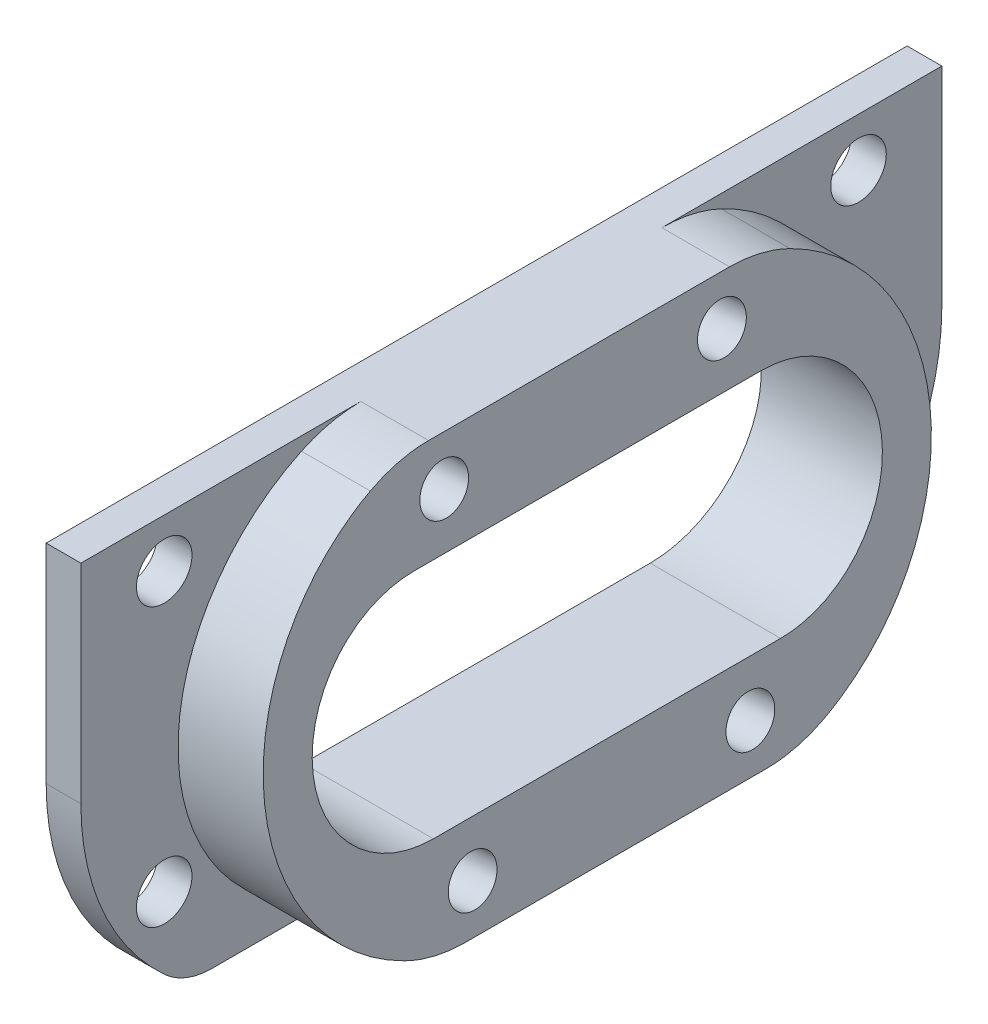
from build123d import *

# Parameters (mm, degrees)
SZKIC1_R                                 = 4
DODANIE_WYCI_GNI_CIE1_DEPTH              = 20
SZKIC2_OUTSIDE_W                         = 153.84
SZKIC2_OUTSIDE_H                         = 89.84
WYTNIJ_WYCI_GNI_CIE1_DEPTH               = 15
WYTNIJ_WYCI_GNI_CIE2_DEPTH               = 130.135587659
WYTNIJ_WYCI_GNI_CIE2_DEPTH_BACK          = 130.135587659
OTW_R_GWINTOWANY_M8X1_01_D               = 7
OTW_R_GWINTOWANY_M8X1_01_DEPTH           = 9.896987833
OTW_R_GWINTOWANY_M8X1_01_TIP             = 2.103012167
OTW_R_GWINTOWANY_M8X1_01_ON_FACE_2_D     = 7
OTW_R_GWINTOWANY_M8X1_01_ON_FACE_2_DEPTH = 9.896987833
OTW_R_GWINTOWANY_M8X1_01_ON_FACE_2_TIP   = 2.103012167


with BuildPart() as part:
    # Szkic1 → Dodanie-wyciągnięcie1 (new body)
    with BuildSketch(Plane(origin=(0, 0, 0), x_dir=(0, 0, -1), z_dir=(1, 0, 0))):
        with BuildLine():
            Line((-43.138357147, -30), (43.138357147, -30))
            ThreePointArc((43.138357147, -30), (46.738768646, -29.329364235), (49.856267202, -27.407407407))
            ThreePointArc((49.856267202, -27.407407407), (58.828108774, -14.988630917), (62, 0))
            Line((62, 0), (62, 30))
            Line((62, 30), (-62, 30))
            Line((-62, 30), (-62, 0))
            ThreePointArc((-62, 0), (-58.828108774, -14.988630917), (-49.856267202, -27.407407407))
            ThreePointArc((-49.856267202, -27.407407407), (-46.738768646, -29.329364235), (-43.138357147, -30))
        make_face()
        with Locations((-50, 23)):
            Circle(SZKIC1_R, mode=Mode.SUBTRACT)
        with Locations((50, 23)):
            Circle(SZKIC1_R, mode=Mode.SUBTRACT)
        with Locations((50, -17)):
            Circle(SZKIC1_R, mode=Mode.SUBTRACT)
        with Locations((-50, -17)):
            Circle(SZKIC1_R, mode=Mode.SUBTRACT)
        with BuildLine():
            Line((-25, -16), (25, -16))
            ThreePointArc((25, -16), (41, 0), (25, 16))
            Line((25, 16), (-25, 16))
            ThreePointArc((-25, 16), (-41, 0), (-25, -16))
        make_face(mode=Mode.SUBTRACT)
    extrude(amount=DODANIE_WYCI_GNI_CIE1_DEPTH)

    # Szkic2 outside → Wytnij-wyciągnięcie1 (cut)
    # profile 1 of 2: a face of its own
    with BuildSketch(Plane(origin=(20, 0, 0), x_dir=(0, 0, -1), z_dir=(1, 0, 0))):
        Rectangle(SZKIC2_OUTSIDE_W, SZKIC2_OUTSIDE_H)
        with BuildLine():
            Line((21.671768561, 30), (-21.671768561, 30))
            ThreePointArc((-21.671768561, 30), (-26.059642547, 29.512728202), (-30.233707808, 28.074656189))
            ThreePointArc((-30.233707808, 28.074656189), (-48, 0), (-30.233707808, -28.074656189))
            ThreePointArc((-30.233707808, -28.074656189), (-26.059642547, -29.512728202), (-21.671768561, -30))
            Line((-21.671768561, -30), (21.671768561, -30))
            ThreePointArc((21.671768561, -30), (26.059642547, -29.512728202), (30.233707808, -28.074656189))
            ThreePointArc((30.233707808, -28.074656189), (48, 0), (30.233707808, 28.074656189))
            ThreePointArc((30.233707808, 28.074656189), (26.059642547, 29.512728202), (21.671768561, 30))
        make_face(mode=Mode.SUBTRACT)
    # profile 2 of 2: a face of its own
    with BuildSketch(Plane(origin=(20, 0, 0), x_dir=(0, 0, -1), z_dir=(1, 0, 0))):
        with BuildLine():
            Line((-25, -16), (25, -16))
            ThreePointArc((25, -16), (41, 0), (25, 16))
            Line((25, 16), (-25, 16))
            ThreePointArc((-25, 16), (-41, 0), (-25, -16))
        make_face()
    extrude(amount=-WYTNIJ_WYCI_GNI_CIE1_DEPTH, mode=Mode.SUBTRACT)

    # Szkic3 → Wytnij-wyciągnięcie2 (cut, two sides: drawn at the far end of the back side and taken through both)
    with BuildSketch(Plane(origin=(0, 0, -62), x_dir=(-1, 0, 0), z_dir=(0, 0, -1)).offset(-WYTNIJ_WYCI_GNI_CIE2_DEPTH_BACK)):
        Polygon((-20, -30), (-20, 30), (-14.750680188, 30), align=None)
    extrude(amount=WYTNIJ_WYCI_GNI_CIE2_DEPTH + WYTNIJ_WYCI_GNI_CIE2_DEPTH_BACK, mode=Mode.SUBTRACT)

    # Otwór gwintowany M8x1.01
    with Locations(Plane(origin=(15.32718014, 23.410575405, 20), x_dir=(-0.087155742748, 0.996194698092, 0), z_dir=(0.996194698092, 0.087155742748, 0))):
        with Locations((0, 0), (-47, -40), (-47, 0)):
            Hole(OTW_R_GWINTOWANY_M8X1_01_D / 2, depth=OTW_R_GWINTOWANY_M8X1_01_DEPTH)
            with Locations((0, 0, -(OTW_R_GWINTOWANY_M8X1_01_DEPTH + OTW_R_GWINTOWANY_M8X1_01_TIP / 2))):  # 118° drill point
                Cone(0, OTW_R_GWINTOWANY_M8X1_01_D / 2, OTW_R_GWINTOWANY_M8X1_01_TIP, mode=Mode.SUBTRACT)

    # Otwór gwintowany M8x1.01 on face 2
    with Locations(Plane(origin=(15.32718014, 23.410575405, -20), x_dir=(-0.087155971833, 0.996194678049, 0), z_dir=(0.996194678049, 0.087155971833, 0))):
        with Locations((0, 0)):
            Hole(OTW_R_GWINTOWANY_M8X1_01_ON_FACE_2_D / 2, depth=OTW_R_GWINTOWANY_M8X1_01_ON_FACE_2_DEPTH)
            with Locations((0, 0, -(OTW_R_GWINTOWANY_M8X1_01_ON_FACE_2_DEPTH + OTW_R_GWINTOWANY_M8X1_01_ON_FACE_2_TIP / 2))):  # 118° drill point
                Cone(0, OTW_R_GWINTOWANY_M8X1_01_ON_FACE_2_D / 2, OTW_R_GWINTOWANY_M8X1_01_ON_FACE_2_TIP, mode=Mode.SUBTRACT)


solid = part.part
